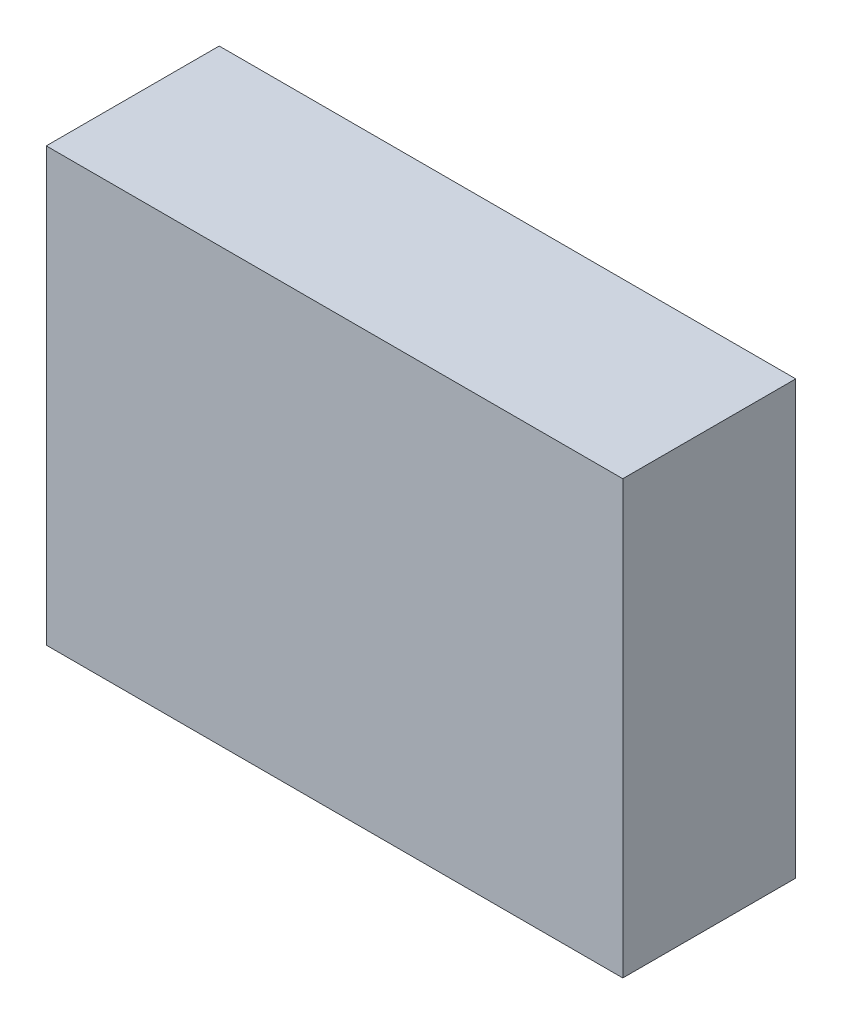
from build123d import *

# Parameters (mm, degrees)
SKETCH_1_W      = 20
SKETCH_1_H      = 15
EXTRUDE_1_DEPTH = 3


with BuildPart() as part:
    # 草图1 → 凸台-拉伸1 (new, symmetric)
    with BuildSketch(Plane.XY):
        Rectangle(SKETCH_1_W, SKETCH_1_H)
    extrude(amount=EXTRUDE_1_DEPTH, both=True)


solid = part.part
